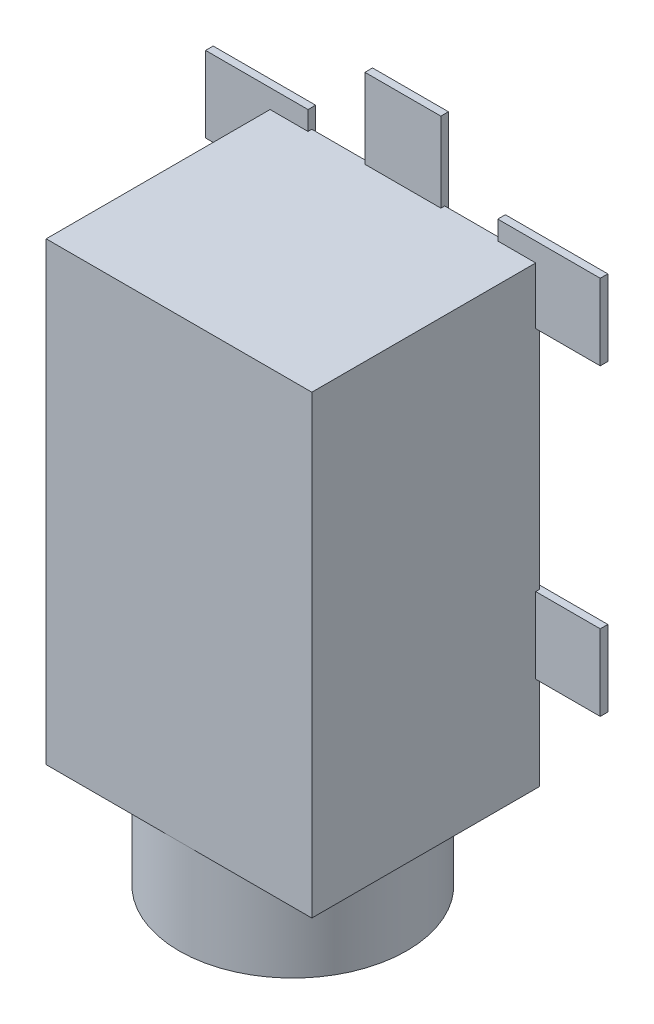
from build123d import *

# Parameters (mm, degrees)
SKETCH1_W           = 7
SKETCH1_H           = 12
BOSS_EXTRUDE1_DEPTH = 6
SKETCH2_R           = 3
SKETCH2_R_2         = 1.9
BOSS_EXTRUDE2_DEPTH = 2.5
SKETCH3_R           = 0.5
BOSS_EXTRUDE3_DEPTH = 1
SKETCH4_W           = 2.7
SKETCH4_H           = 2
SKETCH4_W_2         = 2
SKETCH4_H_2         = 3.1
BOSS_EXTRUDE4_DEPTH = 0.1


with BuildPart() as part:
    # Sketch1 → Boss-Extrude1 (new body)
    with BuildSketch(Plane.XY):
        Rectangle(SKETCH1_W, SKETCH1_H)
    extrude(amount=BOSS_EXTRUDE1_DEPTH)

    # Sketch2 → Boss-Extrude2 (add)
    with BuildSketch(Plane.XZ.offset(6)):
        with Locations((0, 3)):
            Circle(SKETCH2_R)
        with Locations((0, 3)):
            Circle(SKETCH2_R_2, mode=Mode.SUBTRACT)
    extrude(amount=BOSS_EXTRUDE2_DEPTH)

    # Sketch3 → Boss-Extrude3 (add)
    with BuildSketch(Plane(origin=(0, 0, 0), x_dir=(-1, 0, 0), z_dir=(0, 0, -1))):
        with Locations((0, -4)):
            Circle(SKETCH3_R)
        with Locations((0, 3)):
            Circle(SKETCH3_R)
    extrude(amount=BOSS_EXTRUDE3_DEPTH)

    # Sketch4 → Boss-Extrude4 (add, symmetric)
    with BuildSketch(Plane(origin=(0, 0, 0), x_dir=(-1, 0, 0), z_dir=(0, 0, -1))):
        with Locations((3.85, 5.5)):
            Rectangle(SKETCH4_W, SKETCH4_H)
        with Locations((3.85, -2.5)):
            Rectangle(SKETCH4_W, SKETCH4_H)
        with Locations((0, 6.55)):
            Rectangle(SKETCH4_W_2, SKETCH4_H_2)
        with Locations((-3.85, -2.5)):
            Rectangle(SKETCH4_W, SKETCH4_H)
        with Locations((-3.85, 5.5)):
            Rectangle(SKETCH4_W, SKETCH4_H)
    extrude(amount=BOSS_EXTRUDE4_DEPTH, both=True)


solid = part.part
